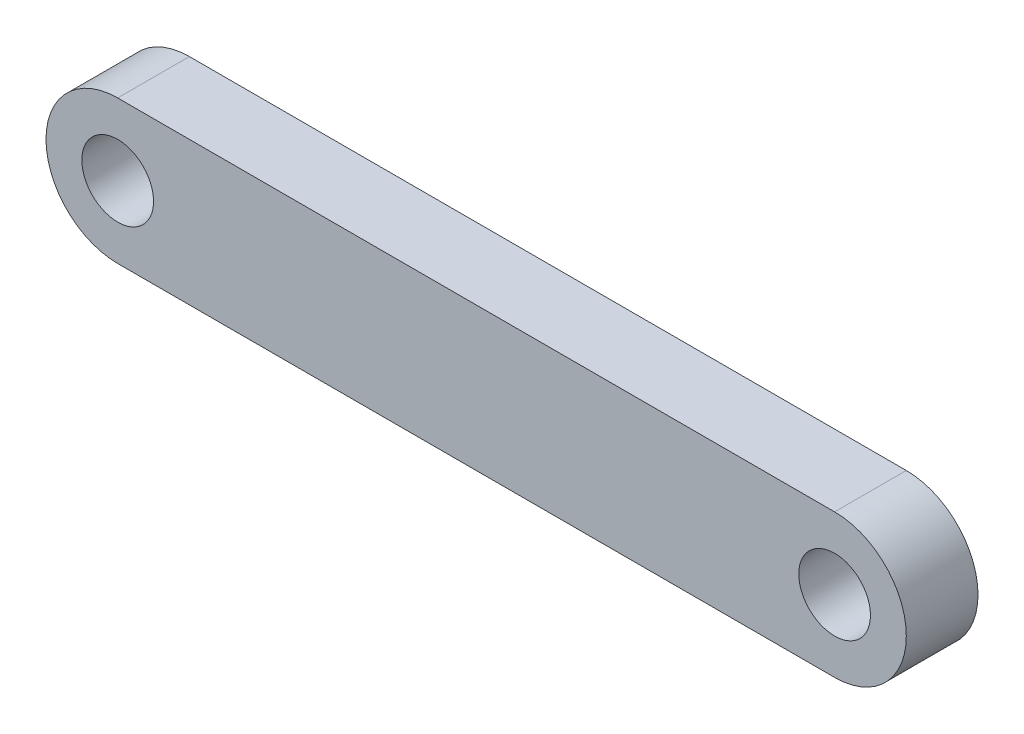
from build123d import *

# Parameters (mm, degrees)
SKETCH1_R           = 5
BOSS_EXTRUDE1_DEPTH = 10


with BuildPart() as part:
    # Sketch1 → Boss-Extrude1 (new body)
    with BuildSketch(Plane.XY):
        with BuildLine():
            Line((-50, 10), (50, 10))
            ThreePointArc((50, 10), (60, 0), (50, -10))
            Line((50, -10), (-50, -10))
            ThreePointArc((-50, -10), (-60, 0), (-50, 10))
        make_face()
        with Locations((50, 0)):
            Circle(SKETCH1_R, mode=Mode.SUBTRACT)
        with Locations(Location((-50, 0, 0), (0, 0, 180))):
            Circle(SKETCH1_R, mode=Mode.SUBTRACT)
    extrude(amount=BOSS_EXTRUDE1_DEPTH)


solid = part.part
